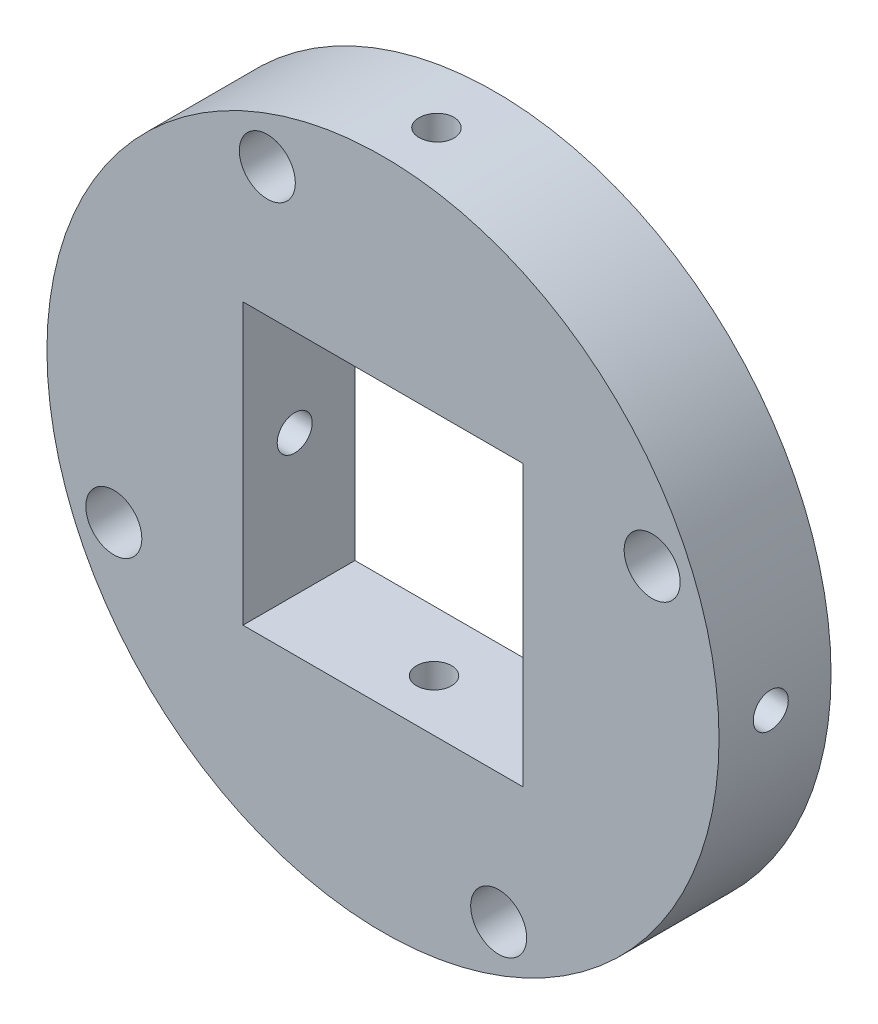
from build123d import *

# Parameters (mm, degrees)
SKETCH1_R           = 7.62
BOSS_EXTRUDE1_DEPTH = 2.54
SKETCH2_W           = 6.35
SKETCH2_H           = 6.35
CUT_EXTRUDE1_DEPTH  = 12.071603317
SKETCH3_R           = 0.635
CUT_EXTRUDE2_DEPTH  = 12.071603317
CIRPATTERN1_COUNT   = 4
CIRPATTERN2_COUNT   = 4


with BuildPart() as part:
    # Sketch1 → Boss-Extrude1 (new body)
    with BuildSketch(Plane.XY):
        Circle(SKETCH1_R)
    extrude(amount=BOSS_EXTRUDE1_DEPTH)

    # Sketch2 → Cut-Extrude1 (cut, through all)
    with BuildSketch(Plane.XY.offset(2.54)):
        Rectangle(SKETCH2_W, SKETCH2_H)
    extrude(amount=-CUT_EXTRUDE1_DEPTH, mode=Mode.SUBTRACT)

    # Sketch3 → Cut-Extrude2 (cut, through all)
    with BuildSketch(Plane.XY.offset(2.54)):
        with Locations((-2.622739109, 6.103536802)):
            Circle(SKETCH3_R)
    cut_extrude2 = extrude(amount=-CUT_EXTRUDE2_DEPTH, mode=Mode.SUBTRACT)

    # CirPattern1: Cut-Extrude2 ×4 about axis
    cirpattern1_axis = Axis((0, 0, 0), (0, 0, 1))
    for i in range(1, CIRPATTERN1_COUNT):
        add(cut_extrude2.rotate(cirpattern1_axis, i * 360 / CIRPATTERN1_COUNT), mode=Mode.SUBTRACT)

    # Sketch6 → 1/32 (0.03125) Diameter Hole1 (revolve, cut)
    with BuildSketch(Plane(origin=(0.038702284, 7.619901714, 1.36675571), x_dir=(-0.9999871015937097, 0.005079039890736663, 0), z_dir=(0, 0, 1))):
        Polygon((0, 0), (0, 6.683017666), (0.396875, 6.35), (0.396875, 0), align=None)
    f_1_32_0_03125_diameter_hole1 = revolve(axis=Axis((0.070954187, 13.969819809, 1.36675571), (-0.005079039890736664, -0.9999871015937097, 0)), mode=Mode.SUBTRACT)

    # CirPattern2: 1/32 (0.03125) Diameter Hole1 ×4 about axis
    cirpattern2_axis = Axis((0, 0, 2.54), (0, 0, -1))
    for i in range(1, CIRPATTERN2_COUNT):
        add(f_1_32_0_03125_diameter_hole1.rotate(cirpattern2_axis, i * 360 / CIRPATTERN2_COUNT), mode=Mode.SUBTRACT)


solid = part.part
